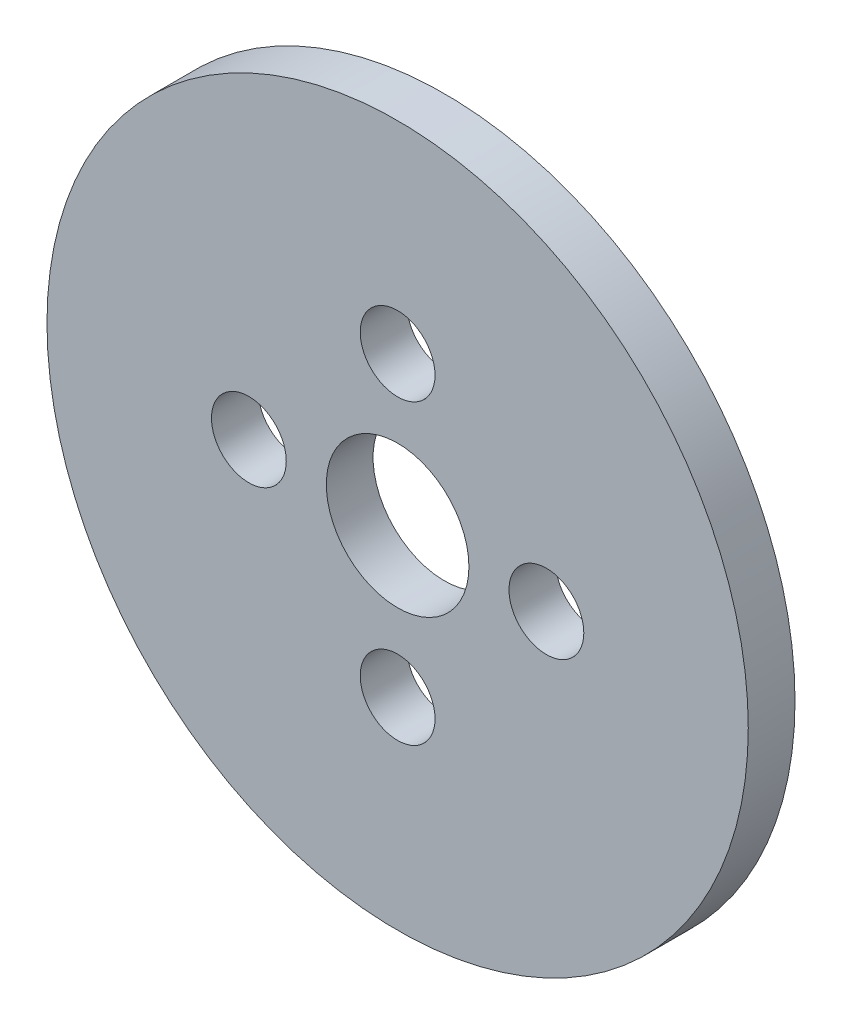
from build123d import *

# Parameters (mm, degrees)
SKETCH_1_R      = 15
SKETCH_1_R_2    = 1.6
SKETCH_1_R_3    = 3.05
EXTRUDE_1_DEPTH = 2


with BuildPart() as part:
    # ｽｹｯﾁ1 → ﾎﾞｽ - 押し出し1 (new body)
    with BuildSketch(Plane.XY):
        Circle(SKETCH_1_R)
        with Locations((0, 6.363961031)):
            Circle(SKETCH_1_R_2, mode=Mode.SUBTRACT)
        with Locations((6.363961031, 0)):
            Circle(SKETCH_1_R_2, mode=Mode.SUBTRACT)
        with Locations((-6.363961031, 0)):
            Circle(SKETCH_1_R_2, mode=Mode.SUBTRACT)
        with Locations((0, -6.363961031)):
            Circle(SKETCH_1_R_2, mode=Mode.SUBTRACT)
        Circle(SKETCH_1_R_3, mode=Mode.SUBTRACT)
    extrude(amount=EXTRUDE_1_DEPTH)


solid = part.part
